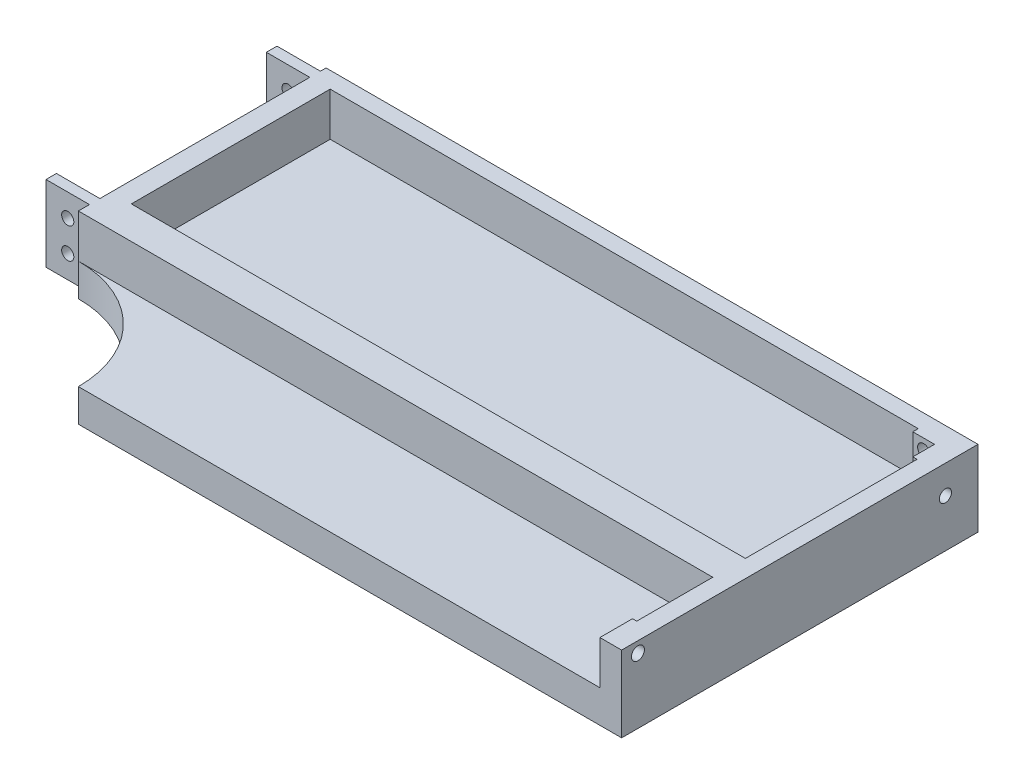
from build123d import *

# Parameters (mm, degrees)
BOSS_EXTRUDE1_DEPTH      = 2.5
BOSS_EXTRUDE1_DEPTH_BACK = 5
SKETCH2_W                = 4.686913728
SKETCH2_H                = 45.75
SKETCH2_W_2              = 4.025662133
SKETCH2_H_2              = 25
BOSS_EXTRUDE2_DEPTH      = 10
SKETCH4_W                = 2.4
SKETCH4_H                = 17.5
SKETCH4_W_2              = 2.45
BOSS_EXTRUDE3_DEPTH      = 10
SKETCH5_R                = 1.4
CUT_EXTRUDE1_DEPTH       = 57
SKETCH6_W                = 5
SKETCH6_H                = 7.5
BOSS_EXTRUDE4_DEPTH      = 10
SKETCH8_R                = 1.4
CUT_EXTRUDE2_DEPTH       = 5
SKETCH9_R                = 1.4
CUT_EXTRUDE3_DEPTH       = 5
SKETCH10_R               = 1.5
CUT_EXTRUDE4_DEPTH       = 5


with BuildPart() as part:
    # Sketch1 → Boss-Extrude1 (new, two sides: drawn at the far end of the back side and taken through both)
    with BuildSketch(Plane(origin=(0, 0, 0), x_dir=(1, 0, 0), z_dir=(0, 1, 0)).offset(-BOSS_EXTRUDE1_DEPTH_BACK)):
        with BuildLine():
            Line((-75, 0), (75, 0))
            Line((75, 0), (75, -82))
            Line((75, -82), (-50, -82))
            ThreePointArc((-50, -82), (-57.32233047, -64.32233047), (-75, -57))
            Line((-75, -57), (-75, 0))
        make_face()
    extrude(amount=BOSS_EXTRUDE1_DEPTH + BOSS_EXTRUDE1_DEPTH_BACK)

    # Sketch2 → Boss-Extrude2 (add)
    with BuildSketch(Plane(origin=(0, 2.5, 0), x_dir=(1, 0, 0), z_dir=(0, 1, 0))):
        with Locations((-72.656543136, -26.625)):
            Rectangle(SKETCH2_W, SKETCH2_H)
        Polygon((-70.313086272, -49.5), (-75, -49.5), (-75, -57), (70.974337867, -57), (75, -57), (75, -49.5), (70.974337867, -49.5), align=None)
        Polygon((75, 0), (-75, 0), (-75, -3.75), (-70.313086272, -3.75), (70.974337867, -3.75), (75, -3.75), align=None)
        with Locations((72.987168934, -26.625)):
            Rectangle(SKETCH2_W_2, SKETCH2_H)
        with Locations((72.987168934, -69.5)):
            Rectangle(SKETCH2_W_2, SKETCH2_H_2)
    extrude(amount=BOSS_EXTRUDE2_DEPTH)

    # Sketch4 → Boss-Extrude3 (add)
    with BuildSketch(Plane.ZY.offset(75)):
        with Locations((53.25, 3.75)):
            Rectangle(SKETCH4_W, SKETCH4_H)
        with Locations((2.525, 3.75)):
            Rectangle(SKETCH4_W_2, SKETCH4_H)
    extrude(amount=BOSS_EXTRUDE3_DEPTH)

    # Sketch5 → Cut-Extrude1 (cut)
    with BuildSketch(Plane(origin=(0, 0, 1.3), x_dir=(-1, 0, 0), z_dir=(0, 0, -1))):
        with Locations((80, 7.25)):
            Circle(SKETCH5_R)
        with Locations((80, 0.25)):
            Circle(SKETCH5_R)
    extrude(amount=-CUT_EXTRUDE1_DEPTH, mode=Mode.SUBTRACT)

    # Sketch6 → Boss-Extrude4 (add)
    with BuildSketch(Plane(origin=(0, 2.5, 0), x_dir=(1, 0, 0), z_dir=(0, 1, 0))):
        Polygon((75, 0), (65, 0), (65, -5), (70, -5), (70, -10), (75, -10), align=None)
        with Locations((72.5, -78.25)):
            Rectangle(SKETCH6_W, SKETCH6_H)
    extrude(amount=BOSS_EXTRUDE4_DEPTH)

    # Sketch8 → Cut-Extrude2 (cut)
    with BuildSketch(Plane.ZY.offset(-70)):
        with Locations((7.5, 6)):
            Circle(SKETCH8_R)
    extrude(amount=-CUT_EXTRUDE2_DEPTH, mode=Mode.SUBTRACT)

    # Sketch9 → Cut-Extrude3 (cut)
    with BuildSketch(Plane.XY.offset(5)):
        with Locations((67.5, 10)):
            Circle(SKETCH9_R)
    extrude(amount=-CUT_EXTRUDE3_DEPTH, mode=Mode.SUBTRACT)

    # Sketch10 → Cut-Extrude4 (cut)
    with BuildSketch(Plane.ZY.offset(-70)):
        with Locations((78.25, 10)):
            Circle(SKETCH10_R)
    extrude(amount=-CUT_EXTRUDE4_DEPTH, mode=Mode.SUBTRACT)


solid = part.part
